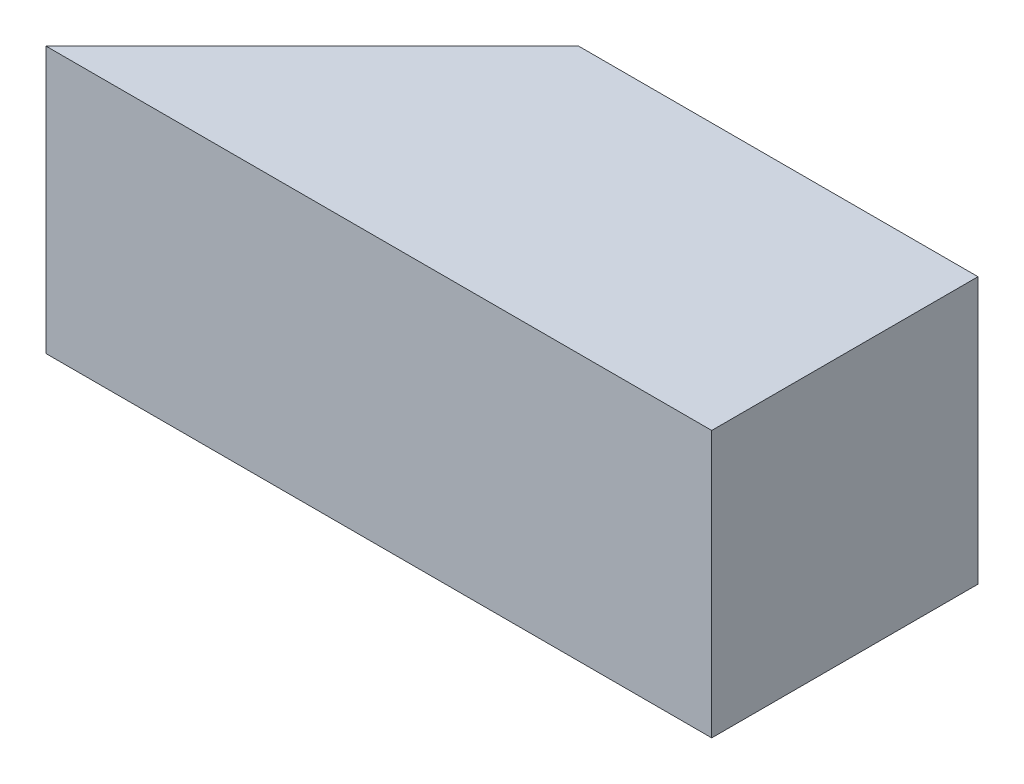
from build123d import *

# Parameters (mm, degrees)
EXTRUDE_1_DEPTH = 40


with BuildPart() as part:
    # Эскиз1 → Бобышка-Вытянуть1 (new body)
    with BuildSketch(Plane(origin=(0, 0, 0), x_dir=(1, 0, 0), z_dir=(0, 1, 0))):
        Polygon((-241.691506493, -177.712147736), (-181.691506493, -177.712147736), (-181.691506493, -217.712147736), (-281.691506493, -217.712147736), align=None)
    extrude(amount=EXTRUDE_1_DEPTH)


solid = part.part
